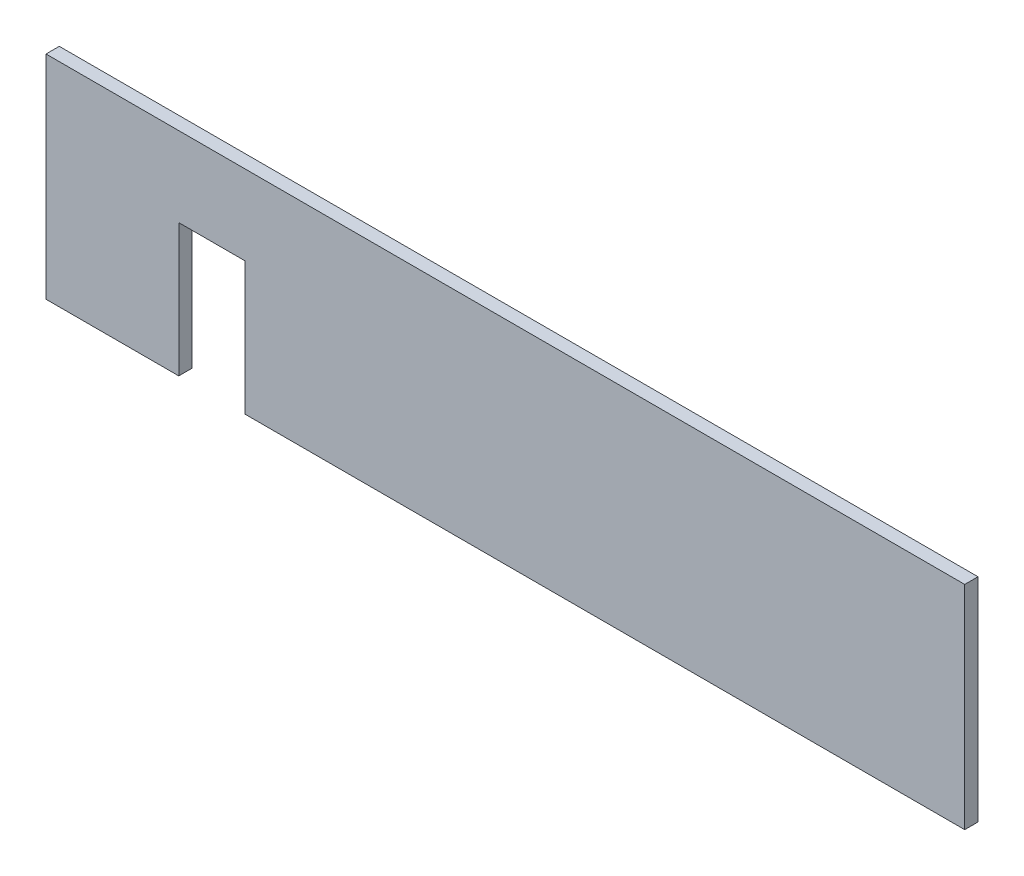
from build123d import *

# Parameters (mm, degrees)
BOSS_EXTRUDE1_DEPTH = 3.175


with BuildPart() as part:
    # Sketch1 → Boss-Extrude1 (new body)
    with BuildSketch(Plane.XY):
        Polygon((0, 0), (0, 50.8), (-219.71, 50.8), (-219.71, 0), (-187.96, 0), (-187.96, 31.75), (-172.085, 31.75), (-172.085, 0), align=None)
    extrude(amount=BOSS_EXTRUDE1_DEPTH)


solid = part.part
